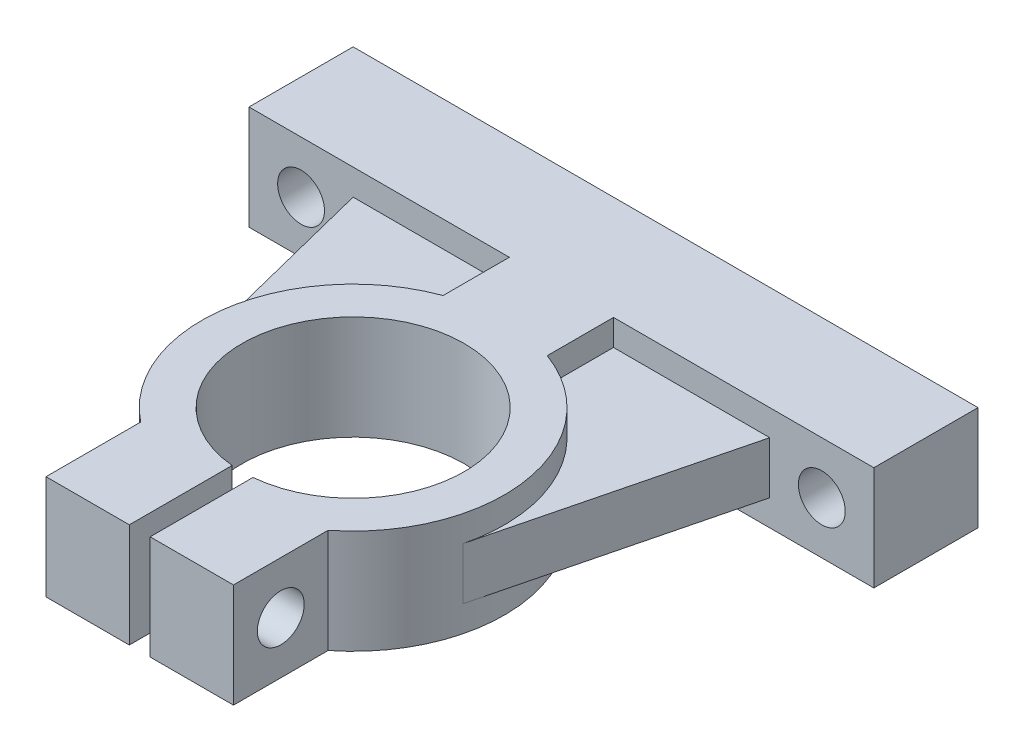
from build123d import *

# Parameters (mm, degrees)
CROQUIS1_R              = 10.668
SALIENTE_EXTRUIR1_DEPTH = 5
CORTAR_EXTRUIR1_REACH   = 55.921
CROQUIS2_R              = 2.25
SALIENTE_EXTRUIR2_DEPTH = 2.5
CROQUIS7_W              = 2
CROQUIS7_H              = 8
CORTAR_EXTRUIR5_DEPTH   = 55.612046519
SALIENTE_EXTRUIR3_DEPTH = 10
CORTAR_EXTRUIR6_REACH   = 65.994
CROQUIS9_R              = 2.25


with BuildPart() as part:
    # Croquis1 → Saliente-Extruir1 (new, symmetric)
    with BuildSketch(Plane(origin=(0, 0, 0), x_dir=(1, 0, 0), z_dir=(0, 1, 0))):
        with BuildLine():
            Line((30, 0), (-30, 0))
            Line((-30, 0), (-30, -10))
            Line((-30, -10), (-5, -10))
            Line((-5, -10), (-5, -16.362711963))
            ThreePointArc((-5, -16.362711963), (0, -44.525), (5, -16.362711963))
            Line((5, -16.362711963), (5, -10))
            Line((5, -10), (30, -10))
            Line((30, -10), (30, 0))
        make_face()
        with Locations(Location((0, -30, 0), (0, 0, 270))):
            Circle(CROQUIS1_R, mode=Mode.SUBTRACT)
    extrude(amount=SALIENTE_EXTRUIR1_DEPTH, both=True)

    # Croquis2 → Cortar-Extruir1 (cut, up to next)
    with BuildSketch(Plane(origin=(0, 0, 0), x_dir=(-1, 0, 0), z_dir=(0, 0, -1)), mode=Mode.PRIVATE) as cortar_extruir1_sk1:
        with Locations((25, 0)):
            Circle(CROQUIS2_R)
    cortar_extruir1_tool1 = extrude(cortar_extruir1_sk1.sketch, amount=-CORTAR_EXTRUIR1_REACH, mode=Mode.PRIVATE) & part.part
    # Croquis2 → Cortar-Extruir1 (cut, up to next)
    with BuildSketch(Plane(origin=(0, 0, 0), x_dir=(-1, 0, 0), z_dir=(0, 0, -1)), mode=Mode.PRIVATE) as cortar_extruir1_sk2:
        with Locations((-25, 0)):
            Circle(CROQUIS2_R)
    cortar_extruir1_tool2 = extrude(cortar_extruir1_sk2.sketch, amount=-CORTAR_EXTRUIR1_REACH, mode=Mode.PRIVATE) & part.part
    add(cortar_extruir1_tool1.solids().sort_by_distance((-25, 0, 0))[0], mode=Mode.SUBTRACT)
    add(cortar_extruir1_tool2.solids().sort_by_distance((25, 0, 0))[0], mode=Mode.SUBTRACT)

    # Croquis3 → Saliente-Extruir2 (add, symmetric)
    with BuildSketch(Plane(origin=(0, 0, 0), x_dir=(1, 0, 0), z_dir=(0, 1, 0))):
        with BuildLine():
            ThreePointArc((-5, -16.362711963), (-12.838793561, -23.207282952), (-14.0873706, -33.53858935))
            Line((-14.0873706, -33.53858935), (-20, -10))
            Line((-20, -10), (-5, -10))
            Line((-5, -10), (-5, -16.362711963))
        make_face()
        with BuildLine():
            Line((5, -10), (5, -16.362711963))
            ThreePointArc((5, -16.362711963), (12.838793561, -23.207282952), (14.0873706, -33.53858935))
            Line((14.0873706, -33.53858935), (20, -10))
            Line((20, -10), (5, -10))
        make_face()
    extrude(amount=SALIENTE_EXTRUIR2_DEPTH, both=True)

    # Croquis7 → Cortar-Extruir5 (cut, through all)
    with BuildSketch(Plane(origin=(0, 5, 0), x_dir=(1, 0, 0), z_dir=(0, 1, 0))):
        with Locations((0, -42.5965)):
            Rectangle(CROQUIS7_W, CROQUIS7_H)
    extrude(amount=-CORTAR_EXTRUIR5_DEPTH, mode=Mode.SUBTRACT)

    # Croquis8 → Saliente-Extruir3 (add)
    with BuildSketch(Plane(origin=(0, 5, 0), x_dir=(1, 0, 0), z_dir=(0, 1, 0))):
        with BuildLine():
            Line((-1, -44.490535704), (-1, -50.490535704))
            Line((-1, -50.490535704), (-9, -50.490535704))
            Line((-9, -50.490535704), (-9, -41.400685286))
            ThreePointArc((-9, -41.400685286), (-5.233239332, -43.549495603), (-1, -44.490535704))
        make_face()
        with BuildLine():
            Line((9, -50.490535704), (9, -41.400685286))
            ThreePointArc((9, -41.400685286), (5.233239332, -43.549495603), (1, -44.490535704))
            Line((1, -44.490535704), (1, -50.490535704))
            Line((1, -50.490535704), (9, -50.490535704))
        make_face()
    extrude(amount=-SALIENTE_EXTRUIR3_DEPTH)

    # Cortar-Extruir6: up to this face of the body (flat: up to its plane)
    cortar_extruir6_end = Plane(part.part.faces().sort_by_distance((-9, 0, 45.945610495))[0])
    # Croquis9 → Cortar-Extruir6 (cut, up to the picked face)
    with BuildSketch(Plane(origin=(9, 0, 0), x_dir=(0, 0, -1), z_dir=(1, 0, 0)), mode=Mode.PRIVATE) as cortar_extruir6_sk1:
        with Locations((-45.945610495, 0)):
            Circle(CROQUIS9_R)
    cortar_extruir6_tool1 = split(extrude(cortar_extruir6_sk1.sketch, amount=-CORTAR_EXTRUIR6_REACH, mode=Mode.PRIVATE), bisect_by=cortar_extruir6_end, keep=Keep.BOTH, mode=Mode.PRIVATE)
    add(cortar_extruir6_tool1.solids().sort_by(Axis((9, 0, 45.94561), (-1, 0, 0)))[0], mode=Mode.SUBTRACT)


solid = part.part
